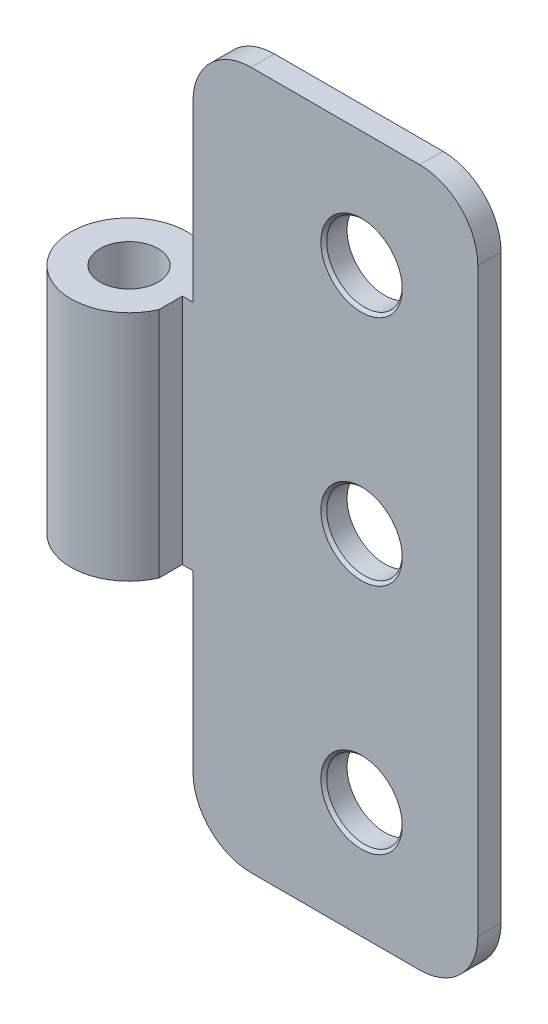
from build123d import *

# Parameters (mm, degrees)
SKETCH1_W                            = 24.5
SKETCH1_H                            = 2
BOSS_EXTRUDE1_DEPTH                  = 30
SKETCH1_4_R                          = 2.5
BOSS_EXTRUDE2_DEPTH                  = 10
F_6_5_6_5_DIAMETER_HOLE1_D           = 6.5
F_6_5_6_5_DIAMETER_HOLE1_CSINK_D     = 7
F_6_5_6_5_DIAMETER_HOLE1_CSINK_ANGLE = 90
FILLET1_R                            = 5


with BuildPart() as part:
    # Sketch1 → Boss-Extrude1 (new, symmetric)
    with BuildSketch(Plane(origin=(0, 0, 0), x_dir=(1, 0, 0), z_dir=(0, 1, 0))):
        with Locations((17.75, 1)):
            Rectangle(SKETCH1_W, SKETCH1_H)
    extrude(amount=BOSS_EXTRUDE1_DEPTH, both=True)

    # Sketch1<4> → Boss-Extrude2 (add, symmetric)
    with BuildSketch(Plane(origin=(0, 0, 0), x_dir=(1, 0, 0), z_dir=(0, 1, 0))):
        with BuildLine():
            Line((5.5, 0), (5.5, 2))
            Line((5.5, 2), (4.582575695, 2))
            ThreePointArc((4.582575695, 2), (-5, 0), (4.582575695, -2))
            Line((4.582575695, -2), (4.582575695, 0))
            Line((4.582575695, 0), (5.5, 0))
        make_face()
        Circle(SKETCH1_4_R, mode=Mode.SUBTRACT)
    extrude(amount=BOSS_EXTRUDE2_DEPTH, both=True)

    # Ø6.5 (6.5) Diameter Hole1 (through all)
    with Locations(Plane(origin=(0, 0, 0), x_dir=(-1, 0, 0), z_dir=(0, 0, 1))):
        with Locations((-20, 20), (-20, 0), (-20, -20)):
            CounterSinkHole(F_6_5_6_5_DIAMETER_HOLE1_D / 2, F_6_5_6_5_DIAMETER_HOLE1_CSINK_D / 2, counter_sink_angle=F_6_5_6_5_DIAMETER_HOLE1_CSINK_ANGLE)

    # Fillet1
    fillet1_edges = [part.edges().sort_by_distance(p)[0] for p in [
        (30, 30, -1),
        (30, -30, -1),
        (5.5, -30, -1),
        (5.5, 30, -1),
    ]]
    fillet(fillet1_edges, radius=FILLET1_R)


solid = part.part
